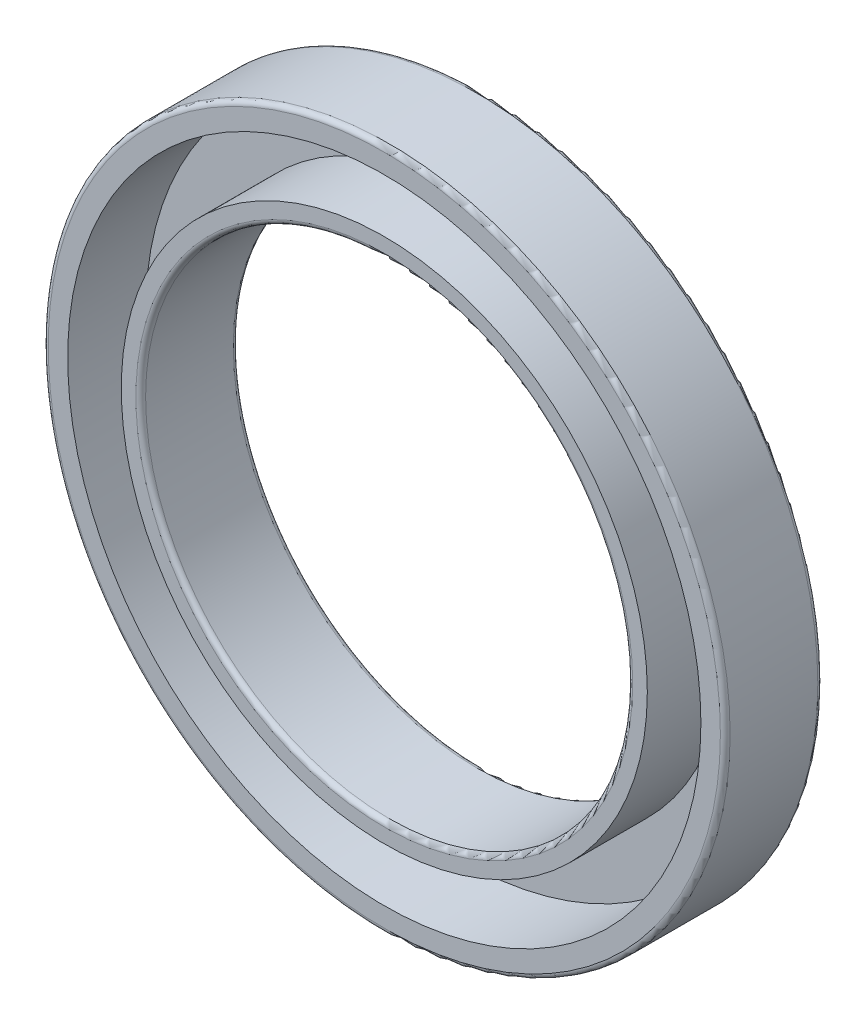
from build123d import *

# Parameters (mm, degrees)
SKETCH1_R           = 35
SKETCH1_R_2         = 25
BOSS_EXTRUDE1_DEPTH = 10
SKETCH2_R           = 32.5
SKETCH2_R_2         = 27
CUT_EXTRUDE1_DEPTH  = 8
FILLET1_R           = 0.5


with BuildPart() as part:
    # Sketch1 → Boss-Extrude1 (new body)
    with BuildSketch(Plane.XY):
        Circle(SKETCH1_R)
        Circle(SKETCH1_R_2, mode=Mode.SUBTRACT)
    extrude(amount=BOSS_EXTRUDE1_DEPTH)

    # Sketch2 → Cut-Extrude1 (cut)
    with BuildSketch(Plane.XY.offset(10)):
        Circle(SKETCH2_R)
        Circle(SKETCH2_R_2, mode=Mode.SUBTRACT)
    extrude(amount=-CUT_EXTRUDE1_DEPTH, mode=Mode.SUBTRACT)

    # Fillet1
    fillet1_edges = [part.edges().sort_by_distance(p)[0] for p in [
        (-35, 0, 0),
        (-35, 0, 10),
        (-25, 0, 0),
        (-25, 0, 10),
    ]]
    fillet(fillet1_edges, radius=FILLET1_R)


solid = part.part
